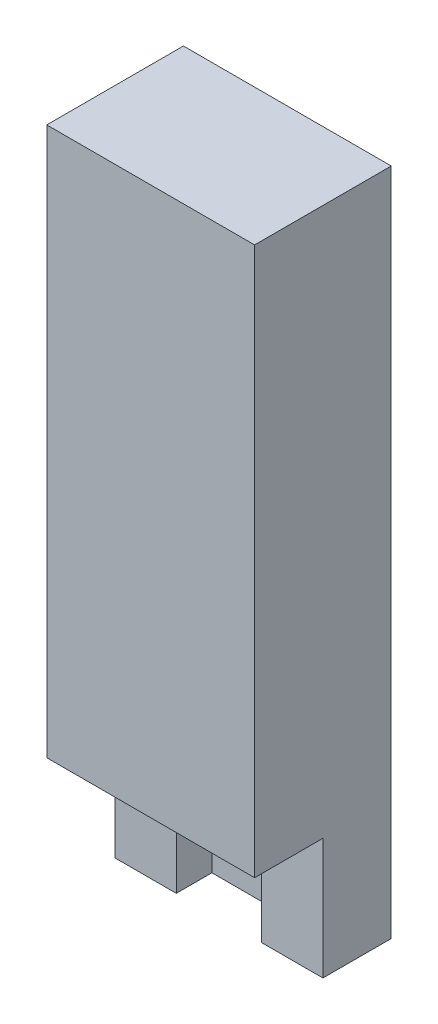
from build123d import *

# Parameters (mm, degrees)
EXTRUDE_1_DEPTH     = 9.6
SKETCH_2_W          = 14.6
SKETCH_2_H          = 8.5
CUT_EXTRUDE_1_DEPTH = 4.8
SKETCH_3_W          = 6
SKETCH_3_H          = 8.5
CUT_EXTRUDE_2_DEPTH = 2.5


with BuildPart() as part:
    # 草图1 → 凸台-拉伸1 (new body)
    with BuildSketch(Plane.XY):
        Polygon((-7.3, 0), (-7.3, 38.5), (7.3, 38.5), (7.3, 0), (7.3, -8.5), (-7.3, -8.5), align=None)
    extrude(amount=EXTRUDE_1_DEPTH)

    # 草图2 → 切除-拉伸1 (cut)
    with BuildSketch(Plane.XY.offset(9.6)):
        with Locations((0, -4.25)):
            Rectangle(SKETCH_2_W, SKETCH_2_H)
    extrude(amount=-CUT_EXTRUDE_1_DEPTH, mode=Mode.SUBTRACT)

    # 草图3 → 切除-拉伸2 (cut)
    with BuildSketch(Plane.XY.offset(4.8)):
        with Locations((0, -4.25)):
            Rectangle(SKETCH_3_W, SKETCH_3_H)
    extrude(amount=-CUT_EXTRUDE_2_DEPTH, mode=Mode.SUBTRACT)


solid = part.part
